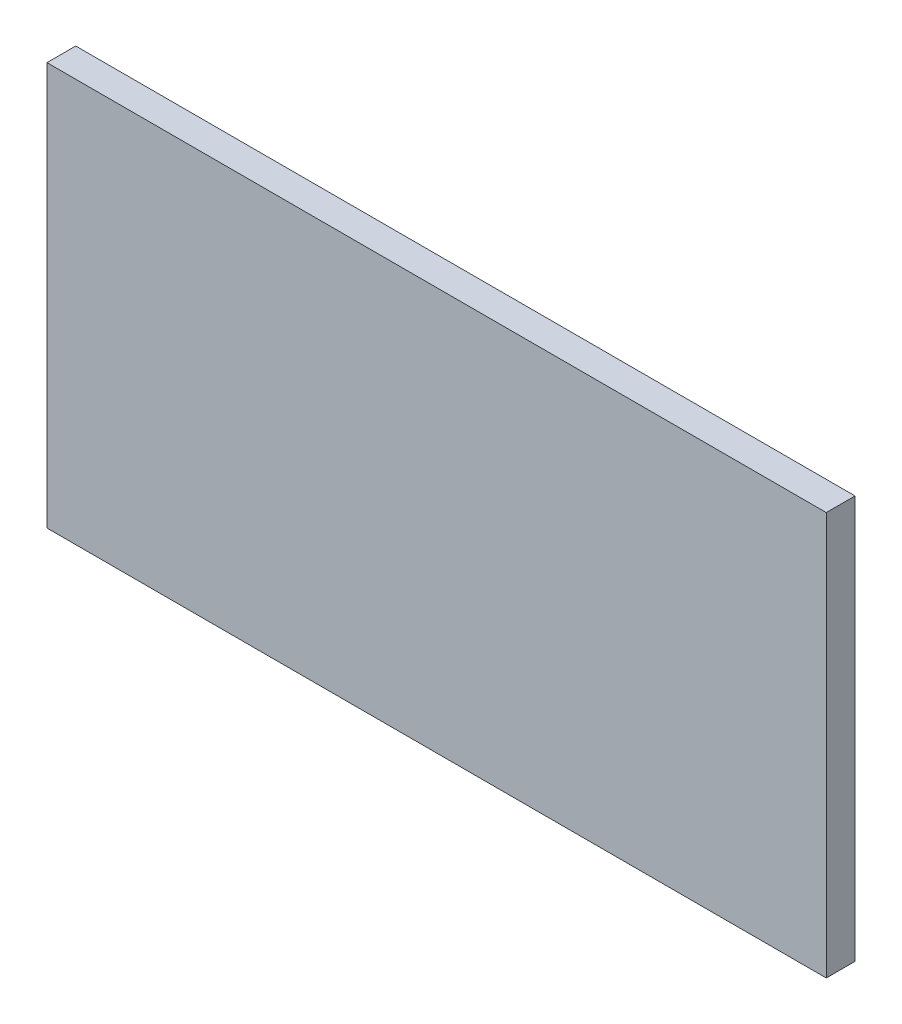
from build123d import *

# Parameters (mm, degrees)
SKETCH1_W           = 40.6
SKETCH1_H           = 21
BOSS_EXTRUDE1_DEPTH = 1.5
SKETCH2_W           = 3.76
SKETCH2_H           = 3
BOSS_EXTRUDE3_DEPTH = 1.1
SKETCH3_R           = 0.25
CUT_EXTRUDE1_DEPTH  = 0.5
FILLET3_R           = 0.5
SKETCH4_R           = 0.65
BOSS_EXTRUDE4_DEPTH = 0.25


with BuildPart() as part:
    # Sketch1 → Boss-Extrude1 (new body)
    with BuildSketch(Plane.XY):
        with Locations((20.3, 10.5)):
            Rectangle(SKETCH1_W, SKETCH1_H)
    extrude(amount=BOSS_EXTRUDE1_DEPTH)

    # Sketch2 → Boss-Extrude3 (add)
    with BuildSketch(Plane(origin=(0, 0, 0), x_dir=(-1, 0, 0), z_dir=(0, 0, -1))):
        with Locations((-8.28, 13.9)):
            Rectangle(SKETCH2_W, SKETCH2_H)
    extrude(amount=BOSS_EXTRUDE3_DEPTH)

    # Sketch3 → Cut-Extrude1 (cut)
    with BuildSketch(Plane(origin=(0, 0, -1.1), x_dir=(-1, 0, 0), z_dir=(0, 0, -1))):
        with Locations((-8.98, 13.9)):
            Circle(SKETCH3_R)
    extrude(amount=-CUT_EXTRUDE1_DEPTH, mode=Mode.SUBTRACT)

    # Fillet3
    fillet3_edges = [part.edges().sort_by_distance(p)[0] for p in [
        (6.4, 13.9, -1.1),
        (8.28, 15.4, -1.1),
        (10.16, 13.9, -1.1),
        (8.28, 12.4, -1.1),
    ]]
    fillet(fillet3_edges, radius=FILLET3_R)

    # Sketch4 → Boss-Extrude4 (add)
    with BuildSketch(Plane(origin=(0, 0, 0), x_dir=(-1, 0, 0), z_dir=(0, 0, -1))):
        with Locations((-18.925, 3.72)):
            Circle(SKETCH4_R)
        with Locations((-20.675, 3.72)):
            Circle(SKETCH4_R)
        with Locations((-20.675, 5.47)):
            Circle(SKETCH4_R)
        with Locations((-20.675, 7.22)):
            Circle(SKETCH4_R)
        with Locations((-18.925, 5.47)):
            Circle(SKETCH4_R)
        with Locations((-18.925, 7.22)):
            Circle(SKETCH4_R)
    extrude(amount=BOSS_EXTRUDE4_DEPTH)


solid = part.part
